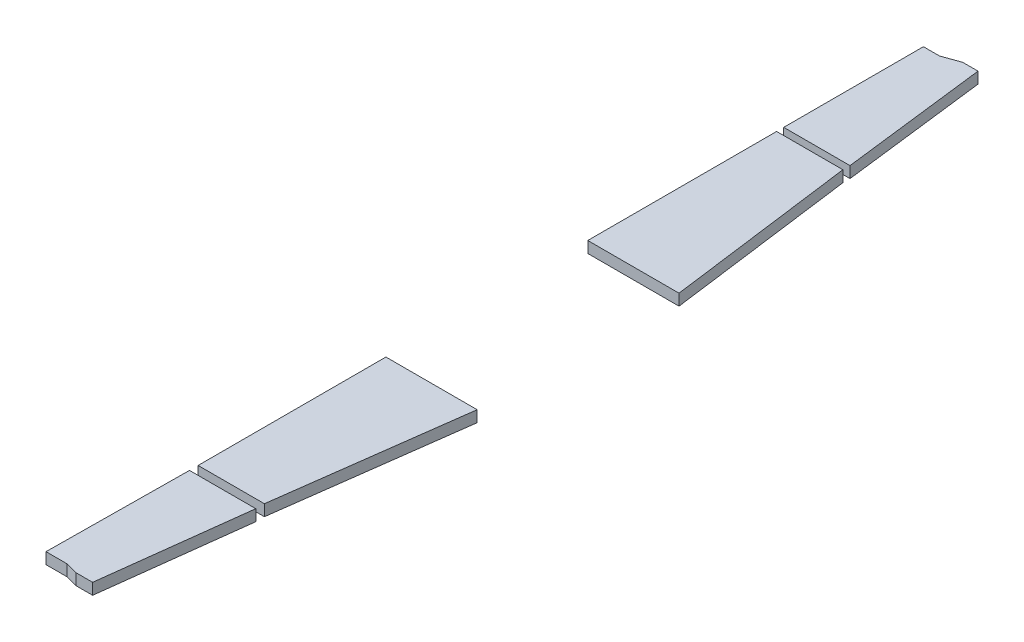
from build123d import *

# Parameters (mm, degrees)
BOSS_EXTRUDE1_DEPTH   = 304.8
BOSS_EXTRUDE1_2_DEPTH = 304.8
BOSS_EXTRUDE1_3_DEPTH = 304.8
BOSS_EXTRUDE1_4_DEPTH = 304.8
SCALE5_SCALE_X        = 0.7
SCALE5_SCALE_Y        = 1
SCALE5_SCALE_Z        = 1


with BuildPart() as part:
    # Sketch1 → Boss-Extrude1 (new body)
    with BuildSketch(Plane(origin=(0, 0, 0), x_dir=(1, 0, 0), z_dir=(0, 1, 0))):
        Polygon((1886.641629334, -10754.970396294), (4446.103774355, -10754.970396294), (3757.655234393, -6813.860152516), (3166.372701844, -6813.860152516), (2506.28949209, -6979.238884979), (1886.641629334, -6979.238884979), align=None)
    extrude(amount=BOSS_EXTRUDE1_DEPTH)


with BuildPart() as body_2:
    # Sketch1 → Boss-Extrude1 2 (new body)
    with BuildSketch(Plane(origin=(0, 0, 0), x_dir=(1, 0, 0), z_dir=(0, 1, 0))):
        Polygon((1886.641629334, -10947.515495193), (4446.103774355, -10947.515495193), (5410.415640064, -16051.764693931), (1886.641629334, -16051.764693931), align=None)
    extrude(amount=BOSS_EXTRUDE1_2_DEPTH)


with BuildPart() as body_3:
    # Sketch1 → Boss-Extrude1 3 (new body)
    with BuildSketch(Plane(origin=(0, 0, 0), x_dir=(1, 0, 0), z_dir=(0, 1, 0))):
        Polygon((1886.641629334, -21507.538468933), (1886.641629334, -26583.606940771), (2301.35615775, -26583.606940771), (4446.103774355, -26583.606940771), (5410.415640064, -21507.538468933), align=None)
    extrude(amount=BOSS_EXTRUDE1_3_DEPTH)


with BuildPart() as body_4:
    # Sketch1 → Boss-Extrude1 4 (new body)
    with BuildSketch(Plane(origin=(0, 0, 0), x_dir=(1, 0, 0), z_dir=(0, 1, 0))):
        Polygon((1886.641629334, -26816.270093761), (1832.636119861, -30657.262573668), (2648.847021842, -30657.262573668), (3108.538310626, -30744.591136472), (3757.655234393, -30744.591136472), (4446.103774355, -26816.270093761), align=None)
    extrude(amount=BOSS_EXTRUDE1_4_DEPTH)


with BuildPart() as body_3_1:
    # Scale5: scaled about (0, 0, 0)
    add(body_3.part.scale((SCALE5_SCALE_X, SCALE5_SCALE_Y, SCALE5_SCALE_Z), about=(0, 0, 0)))


with BuildPart() as body_4_1:
    # Scale5: scaled about (0, 0, 0)
    add(body_4.part.scale((SCALE5_SCALE_X, SCALE5_SCALE_Y, SCALE5_SCALE_Z), about=(0, 0, 0)))


with BuildPart() as part_1:
    # Scale5: scaled about (0, 0, 0)
    add(part.part.scale((SCALE5_SCALE_X, SCALE5_SCALE_Y, SCALE5_SCALE_Z), about=(0, 0, 0)))


with BuildPart() as body_2_1:
    # Scale5: scaled about (0, 0, 0)
    add(body_2.part.scale((SCALE5_SCALE_X, SCALE5_SCALE_Y, SCALE5_SCALE_Z), about=(0, 0, 0)))


solid = Compound([body_3_1.part, body_4_1.part, part_1.part, body_2_1.part])
